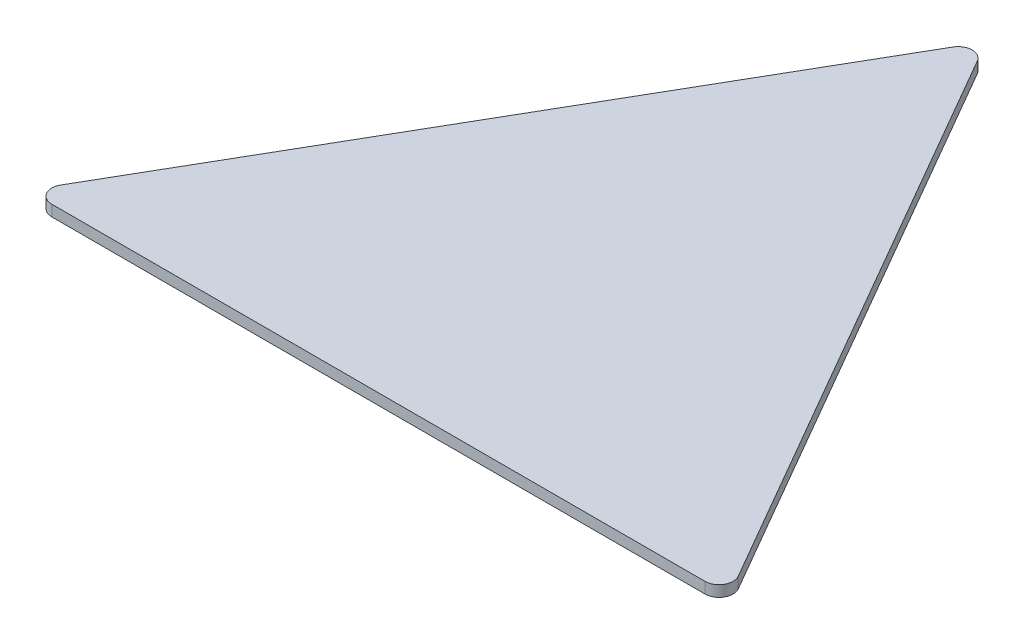
from build123d import *

# Parameters (mm, degrees)
BOSS_EXTRUDE1_DEPTH = 3.9878
FILLET1_R           = 5.08


with BuildPart() as part:
    # Sketch1 → Boss-Extrude1 (new body)
    with BuildSketch(Plane(origin=(0, 0, 0), x_dir=(1, 0, 0), z_dir=(0, 1, 0))):
        Polygon((0, 146.646968374), (-127, -73.323484187), (127, -73.323484187), align=None)
    extrude(amount=BOSS_EXTRUDE1_DEPTH)

    # Fillet1
    fillet1_edges = [part.edges().sort_by_distance(p)[0] for p in [
        (127, 1.9939, 73.323484187),
        (-127, 1.9939, 73.323484187),
        (0, 1.9939, -146.646968374),
    ]]
    fillet(fillet1_edges, radius=FILLET1_R)


solid = part.part
